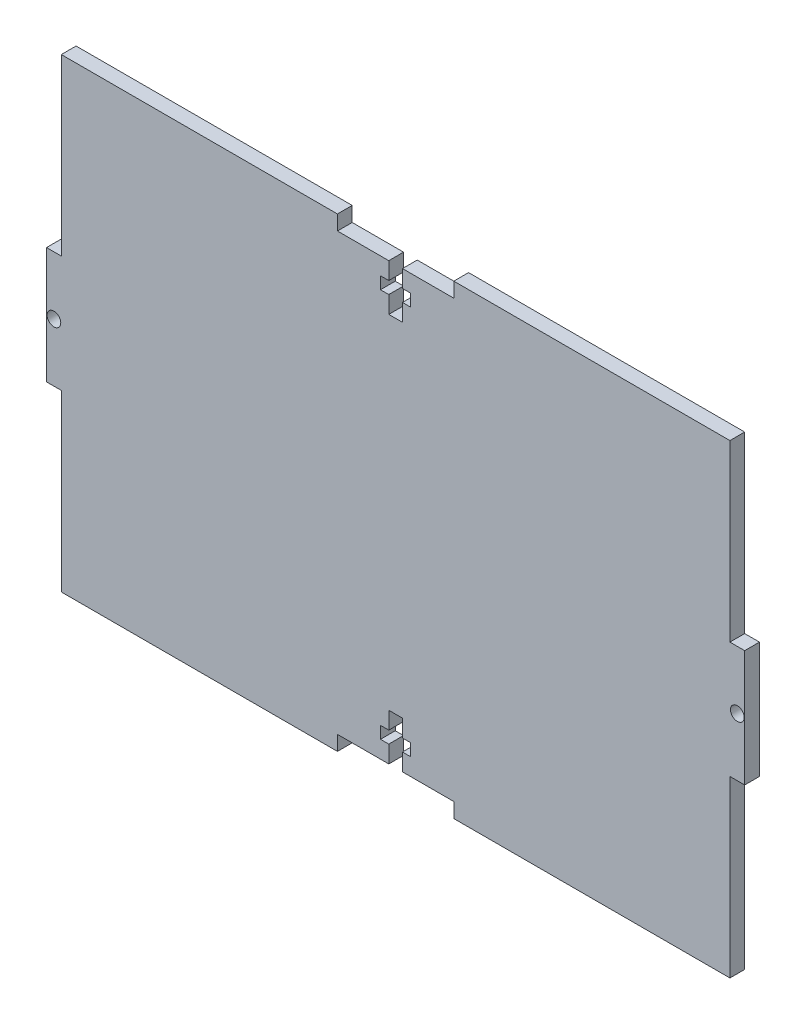
from build123d import *

# Parameters (mm, degrees)
SKETCH1_R           = 1.47
BOSS_EXTRUDE1_DEPTH = 1.5875


with BuildPart() as part:
    # Sketch1 → Boss-Extrude1 (new, symmetric)
    with BuildSketch(Plane.XY):
        Polygon((-12.5, 50), (-71.825, 50), (-71.825, 12.5), (-75, 12.5), (-75, -12.5), (-71.825, -12.5), (-71.825, -50), (-12.5, -50), (-12.5, -46.825), (-1.47, -46.825), (-1.47, -43.125), (-3.25, -43.125), (-3.25, -40.525), (-1.47, -40.525), (-1.47, -36.825), (1.47, -36.825), (1.47, -40.525), (3.25, -40.525), (3.25, -43.125), (1.47, -43.125), (1.47, -46.825), (12.5, -46.825), (12.5, -50), (71.825, -50), (71.825, -12.5), (75, -12.5), (75, 12.5), (71.825, 12.5), (71.825, 50), (12.5, 50), (12.5, 46.825), (1.47, 46.825), (1.47, 43.125), (3.25, 43.125), (3.25, 40.525), (1.47, 40.525), (1.47, 36.825), (-1.47, 36.825), (-1.47, 40.525), (-3.25, 40.525), (-3.25, 43.125), (-1.47, 43.125), (-1.47, 46.825), (-12.5, 46.825), align=None)
        with Locations((-73.4125, 0)):
            Circle(SKETCH1_R, mode=Mode.SUBTRACT)
        with Locations(Location((73.4125, 0, 0), (0, 0, 180))):
            Circle(SKETCH1_R, mode=Mode.SUBTRACT)
    extrude(amount=BOSS_EXTRUDE1_DEPTH, both=True)


solid = part.part
